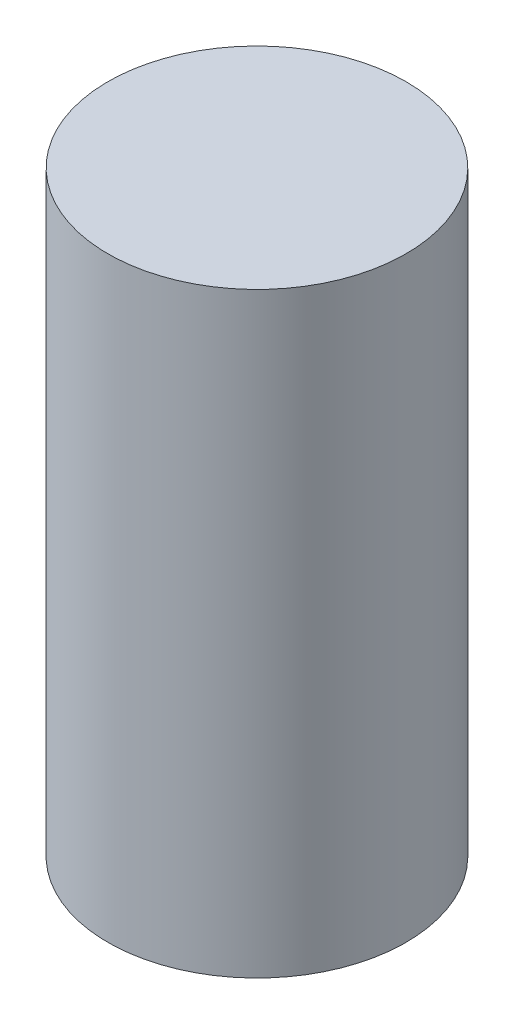
from build123d import *

# Parameters (mm, degrees)
SKETCH1_R           = 19.05
BOSS_EXTRUDE1_DEPTH = 76.2


with BuildPart() as part:
    # Sketch1 → Boss-Extrude1 (new body)
    with BuildSketch(Plane(origin=(0, 0, 0), x_dir=(1, 0, 0), z_dir=(0, 1, 0))):
        with Locations(Location((0, 0, 0), (0, 0, 90))):
            Circle(SKETCH1_R)
    extrude(amount=BOSS_EXTRUDE1_DEPTH)


solid = part.part
